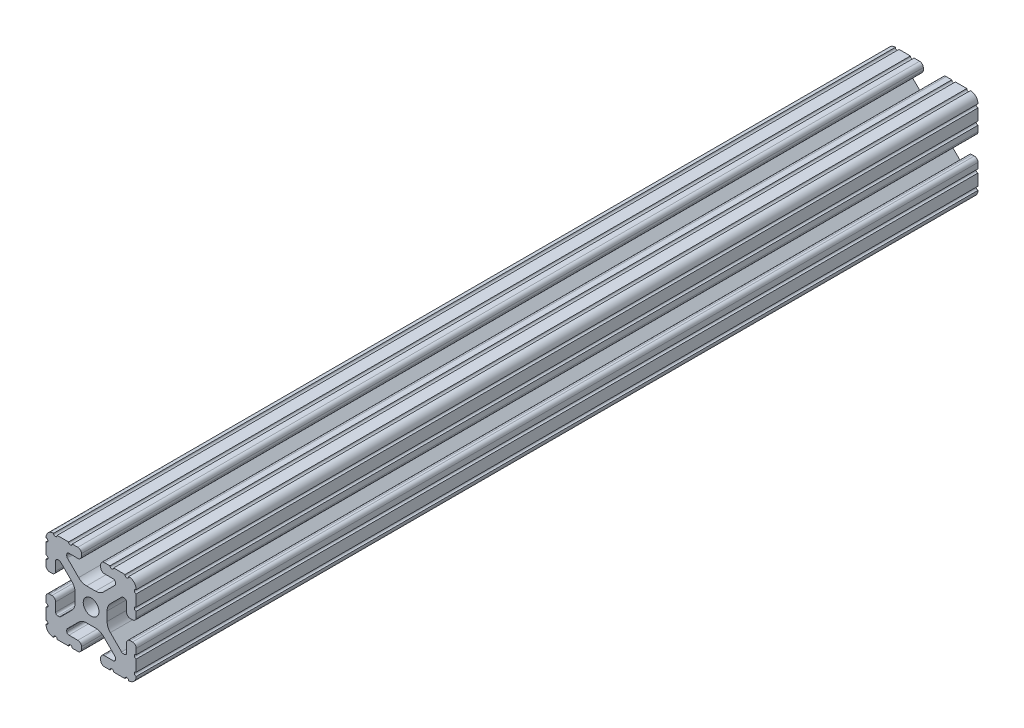
from build123d import *

# Parameters (mm, degrees)
SKETCH1_R      = 3.3274
EXTRUDE1_DEPTH = 355.6


with BuildPart() as part:
    # Sketch1 → Extrude1 (new body)
    with BuildSketch(Plane.XY):
        with BuildLine():
            Line((-10.022898969, 12.91475973), (-5.252158105, 8.144007132))
            ThreePointArc((-5.252158105, 8.144007132), (-3.715177372, 7.117027388), (-1.902183975, 6.7564))
            Line((-1.902183975, 6.7564), (1.902183975, 6.7564))
            ThreePointArc((1.902183975, 6.7564), (3.715177372, 7.117027388), (5.252158105, 8.144007132))
            Line((5.252158105, 8.144007132), (10.022898969, 12.91475973))
            ThreePointArc((10.022898969, 12.91475973), (10.218362387, 13.207291992), (10.287, 13.552357131))
            Line((10.287, 13.552357131), (10.287, 14.0843))
            ThreePointArc((10.287, 14.0843), (10.022898185, 14.721898185), (9.3853, 14.986))
            Line((9.3853, 14.986), (5.617617549, 14.986))
            ThreePointArc((5.617617549, 14.986), (4.519044045, 15.441044045), (4.064, 16.539617549))
            Line((4.064, 16.539617549), (4.064, 17.496382451))
            ThreePointArc((4.064, 17.496382451), (4.519044045, 18.594955955), (5.617617549, 19.05))
            Line((5.617617549, 19.05), (7.974178704, 19.05))
            ThreePointArc((7.974178704, 19.05), (8.736178704, 18.288), (9.498178704, 19.05))
            Line((9.498178704, 19.05), (14.327719207, 19.05))
            ThreePointArc((14.327719207, 19.05), (15.087603123, 18.231251131), (15.847487039, 19.05))
            ThreePointArc((15.847487039, 19.05), (18.120176289, 18.120192083), (19.05, 15.847509295))
            ThreePointArc((19.05, 15.847509295), (18.231250992, 15.08762539), (19.05, 14.327741484))
            Line((19.05, 14.327741484), (19.05, 9.496091471))
            ThreePointArc((19.05, 9.496091471), (18.231250992, 8.736207565), (19.05, 7.97632366))
            Line((19.05, 7.97632366), (19.05, 5.617617549))
            ThreePointArc((19.05, 5.617617549), (18.594955955, 4.519044045), (17.496382451, 4.064))
            Line((17.496382451, 4.064), (16.539617549, 4.064))
            ThreePointArc((16.539617549, 4.064), (15.441044045, 4.519044045), (14.986, 5.617617549))
            Line((14.986, 5.617617549), (14.986, 9.385342516))
            ThreePointArc((14.986, 9.385342516), (14.721898185, 10.022940701), (14.0843, 10.287042516))
            Line((14.0843, 10.287042516), (13.516042086, 10.287042516))
            ThreePointArc((13.516042086, 10.287042516), (13.170975923, 10.218404478), (12.878443117, 10.022939917))
            Line((12.878443117, 10.022939917), (8.14758008, 5.292065243))
            ThreePointArc((8.14758008, 5.292065243), (7.117955879, 3.751120653), (6.7564, 1.933453584))
            Line((6.7564, 1.933453584), (6.7564, -1.933453584))
            ThreePointArc((6.7564, -1.933453584), (7.117955879, -3.751120653), (8.14758008, -5.292065243))
            Line((8.14758008, -5.292065243), (12.878443117, -10.022939917))
            ThreePointArc((12.878443117, -10.022939917), (13.170975923, -10.218404478), (13.516042086, -10.287042516))
            Line((13.516042086, -10.287042516), (14.0843, -10.287042516))
            ThreePointArc((14.0843, -10.287042516), (14.721898185, -10.022940701), (14.986, -9.385342516))
            Line((14.986, -9.385342516), (14.986, -5.617617549))
            ThreePointArc((14.986, -5.617617549), (15.441044045, -4.519044045), (16.539617549, -4.064))
            Line((16.539617549, -4.064), (17.496382451, -4.064))
            ThreePointArc((17.496382451, -4.064), (18.594955955, -4.519044045), (19.05, -5.617617549))
            Line((19.05, -5.617617549), (19.05, -7.976318491))
            ThreePointArc((19.05, -7.976318491), (18.231250992, -8.736202396), (19.05, -9.496086302))
            Line((19.05, -9.496086302), (19.05, -14.32774291))
            ThreePointArc((19.05, -14.32774291), (18.231250992, -15.087626816), (19.05, -15.847510721))
            ThreePointArc((19.05, -15.847510721), (18.120175716, -18.120192644), (15.847486868, -19.05))
            ThreePointArc((15.847486868, -19.05), (15.087602952, -18.231251131), (14.327719036, -19.05))
            Line((14.327719036, -19.05), (9.496062448, -19.05))
            ThreePointArc((9.496062448, -19.05), (8.736178532, -18.231251131), (7.976294616, -19.05))
            Line((7.976294616, -19.05), (5.617617549, -19.05))
            ThreePointArc((5.617617549, -19.05), (4.519044045, -18.594955955), (4.064, -17.496382451))
            Line((4.064, -17.496382451), (4.064, -16.539617549))
            ThreePointArc((4.064, -16.539617549), (4.519044045, -15.441044045), (5.617617549, -14.986))
            Line((5.617617549, -14.986), (9.3853, -14.986))
            ThreePointArc((9.3853, -14.986), (10.022898185, -14.721898185), (10.287, -14.0843))
            Line((10.287, -14.0843), (10.287, -13.552357131))
            ThreePointArc((10.287, -13.552357131), (10.218362387, -13.207291992), (10.022898969, -12.91475973))
            Line((10.022898969, -12.91475973), (5.252158105, -8.144007132))
            ThreePointArc((5.252158105, -8.144007132), (3.715177372, -7.117027388), (1.902183975, -6.7564))
            Line((1.902183975, -6.7564), (-1.902183975, -6.7564))
            ThreePointArc((-1.902183975, -6.7564), (-3.715177372, -7.117027388), (-5.252158105, -8.144007132))
            Line((-5.252158105, -8.144007132), (-10.022898969, -12.91475973))
            ThreePointArc((-10.022898969, -12.91475973), (-10.218362387, -13.207291992), (-10.287, -13.552357131))
            Line((-10.287, -13.552357131), (-10.287, -14.0843))
            ThreePointArc((-10.287, -14.0843), (-10.022898185, -14.721898185), (-9.3853, -14.986))
            Line((-9.3853, -14.986), (-5.617617549, -14.986))
            ThreePointArc((-5.617617549, -14.986), (-4.519044045, -15.441044045), (-4.064, -16.539617549))
            Line((-4.064, -16.539617549), (-4.064, -17.496382451))
            ThreePointArc((-4.064, -17.496382451), (-4.519044045, -18.594955955), (-5.617617549, -19.05))
            Line((-5.617617549, -19.05), (-7.976294616, -19.05))
            ThreePointArc((-7.976294616, -19.05), (-8.736178532, -18.231251131), (-9.496062448, -19.05))
            Line((-9.496062448, -19.05), (-14.327719036, -19.05))
            ThreePointArc((-14.327719036, -19.05), (-15.087602952, -18.231251131), (-15.847486868, -19.05))
            ThreePointArc((-15.847486868, -19.05), (-18.120175716, -18.120192644), (-19.05, -15.847510721))
            ThreePointArc((-19.05, -15.847510721), (-18.231250992, -15.087626816), (-19.05, -14.32774291))
            Line((-19.05, -14.32774291), (-19.05, -9.496086302))
            ThreePointArc((-19.05, -9.496086302), (-18.231250992, -8.736202396), (-19.05, -7.976318491))
            Line((-19.05, -7.976318491), (-19.05, -5.617617549))
            ThreePointArc((-19.05, -5.617617549), (-18.594955955, -4.519044045), (-17.496382451, -4.064))
            Line((-17.496382451, -4.064), (-16.539617549, -4.064))
            ThreePointArc((-16.539617549, -4.064), (-15.441044045, -4.519044045), (-14.986, -5.617617549))
            Line((-14.986, -5.617617549), (-14.986, -9.385342516))
            ThreePointArc((-14.986, -9.385342516), (-14.721898185, -10.022940701), (-14.0843, -10.287042516))
            Line((-14.0843, -10.287042516), (-13.516042086, -10.287042516))
            ThreePointArc((-13.516042086, -10.287042516), (-13.170975923, -10.218404478), (-12.878443117, -10.022939917))
            Line((-12.878443117, -10.022939917), (-8.14758008, -5.292065243))
            ThreePointArc((-8.14758008, -5.292065243), (-7.117955879, -3.751120653), (-6.7564, -1.933453584))
            Line((-6.7564, -1.933453584), (-6.7564, 1.933453584))
            ThreePointArc((-6.7564, 1.933453584), (-7.117955879, 3.751120653), (-8.14758008, 5.292065243))
            Line((-8.14758008, 5.292065243), (-12.878443117, 10.022939917))
            ThreePointArc((-12.878443117, 10.022939917), (-13.170975923, 10.218404478), (-13.516042086, 10.287042516))
            Line((-13.516042086, 10.287042516), (-14.0843, 10.287042516))
            ThreePointArc((-14.0843, 10.287042516), (-14.721898185, 10.022940701), (-14.986, 9.385342516))
            Line((-14.986, 9.385342516), (-14.986, 5.617617549))
            ThreePointArc((-14.986, 5.617617549), (-15.441044045, 4.519044045), (-16.539617549, 4.064))
            Line((-16.539617549, 4.064), (-17.496382451, 4.064))
            ThreePointArc((-17.496382451, 4.064), (-18.594955955, 4.519044045), (-19.05, 5.617617549))
            Line((-19.05, 5.617617549), (-19.05, 7.97632366))
            ThreePointArc((-19.05, 7.97632366), (-18.231250992, 8.736207565), (-19.05, 9.496091471))
            Line((-19.05, 9.496091471), (-19.05, 14.327741484))
            ThreePointArc((-19.05, 14.327741484), (-18.231250992, 15.08762539), (-19.05, 15.847509295))
            ThreePointArc((-19.05, 15.847509295), (-18.120176289, 18.120192083), (-15.847487039, 19.05))
            ThreePointArc((-15.847487039, 19.05), (-15.087603123, 18.231251131), (-14.327719207, 19.05))
            Line((-14.327719207, 19.05), (-9.498178704, 19.05))
            ThreePointArc((-9.498178704, 19.05), (-8.736178704, 18.288), (-7.974178704, 19.05))
            Line((-7.974178704, 19.05), (-5.617617549, 19.05))
            ThreePointArc((-5.617617549, 19.05), (-4.519044045, 18.594955955), (-4.064, 17.496382451))
            Line((-4.064, 17.496382451), (-4.064, 16.539617549))
            ThreePointArc((-4.064, 16.539617549), (-4.519044045, 15.441044045), (-5.617617549, 14.986))
            Line((-5.617617549, 14.986), (-9.3853, 14.986))
            ThreePointArc((-9.3853, 14.986), (-10.022898185, 14.721898185), (-10.287, 14.0843))
            Line((-10.287, 14.0843), (-10.287, 13.552357131))
            ThreePointArc((-10.287, 13.552357131), (-10.218362387, 13.207291992), (-10.022898969, 12.91475973))
        make_face()
        Circle(SKETCH1_R, mode=Mode.SUBTRACT)
    extrude(amount=-EXTRUDE1_DEPTH)


solid = part.part
